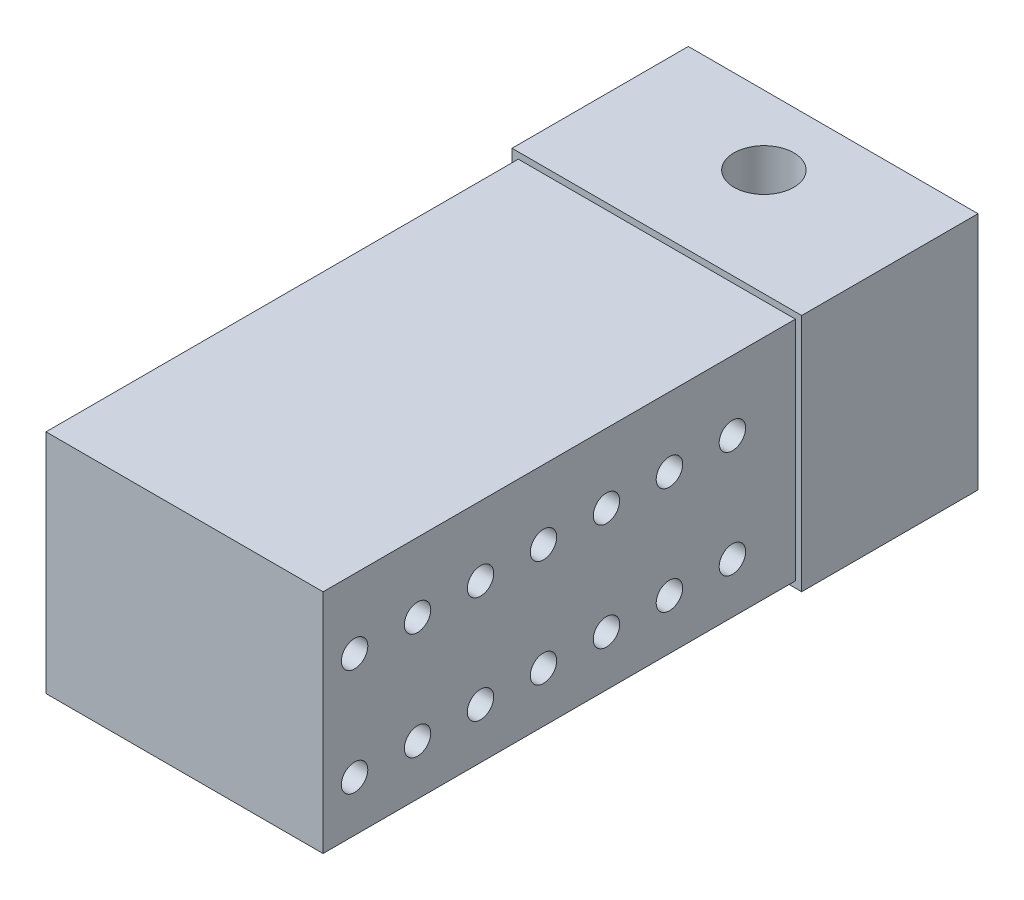
from build123d import *

# Parameters (mm, degrees)
SKETCH1_W               = 11.684
SKETCH1_H               = 9.652
BOSS_EXTRUDE1_DEPTH     = 7.112
CUT_EXTRUDE1_DEPTH      = 14.336814162
CUT_EXTRUDE1_DEPTH_BACK = 14.336814162
SKETCH2_R               = 1.2065
SKETCH7_W               = 11.176
SKETCH7_H               = 9.144
BOSS_EXTRUDE3_DEPTH     = 19.05
SKETCH9_R               = 0.5334
CUT_EXTRUDE2_DEPTH      = 29.954885943


with BuildPart() as part:
    # Sketch1 → Boss-Extrude1 (new body)
    with BuildSketch(Plane.XY):
        Rectangle(SKETCH1_W, SKETCH1_H)
        Polygon((-4.064, -3.048), (4.064, -3.048), (4.064, -0.381), (3.048, -0.381), (3.048, 3.048), (-3.048, 3.048), (-3.048, -0.381), (-4.064, -0.381), align=None, mode=Mode.SUBTRACT)
    extrude(amount=BOSS_EXTRUDE1_DEPTH)

    # Sketch2 → Cut-Extrude1 (cut, two sides: drawn at the far end of the back side and taken through both)
    with BuildSketch(Plane(origin=(0, 4.826, 0), x_dir=(1, 0, 0), z_dir=(0, 1, 0)).offset(-CUT_EXTRUDE1_DEPTH_BACK)):
        with Locations(Location((0, -2.794, 0), (0, 0, 90))):
            Circle(SKETCH2_R)
    extrude(amount=CUT_EXTRUDE1_DEPTH + CUT_EXTRUDE1_DEPTH_BACK, mode=Mode.SUBTRACT)

    # Sketch7 → Boss-Extrude3 (add)
    with BuildSketch(Plane.XY.offset(7.112)):
        Rectangle(SKETCH7_W, SKETCH7_H)
    extrude(amount=BOSS_EXTRUDE3_DEPTH)

    # Sketch9 → Cut-Extrude2 (cut, through all)
    with BuildSketch(Plane(origin=(5.588, 0, 0), x_dir=(0, 0, -1), z_dir=(1, 0, 0))):
        with Locations((-9.652, -2.54)):
            Circle(SKETCH9_R)
        with Locations((-12.192, -2.54)):
            Circle(SKETCH9_R)
        with Locations((-14.732, -2.54)):
            Circle(SKETCH9_R)
        with Locations((-17.272, -2.54)):
            Circle(SKETCH9_R)
        with Locations((-19.812, -2.54)):
            Circle(SKETCH9_R)
        with Locations((-22.352, -2.54)):
            Circle(SKETCH9_R)
        with Locations((-24.892, -2.54)):
            Circle(SKETCH9_R)
        with Locations((-12.192, 1.778)):
            Circle(SKETCH9_R)
        with Locations((-14.732, 1.778)):
            Circle(SKETCH9_R)
        with Locations((-17.272, 1.778)):
            Circle(SKETCH9_R)
        with Locations((-19.812, 1.778)):
            Circle(SKETCH9_R)
        with Locations((-22.352, 1.778)):
            Circle(SKETCH9_R)
        with Locations((-24.892, 1.778)):
            Circle(SKETCH9_R)
        with Locations((-9.652, 1.778)):
            Circle(SKETCH9_R)
    extrude(amount=-CUT_EXTRUDE2_DEPTH, mode=Mode.SUBTRACT)


solid = part.part
